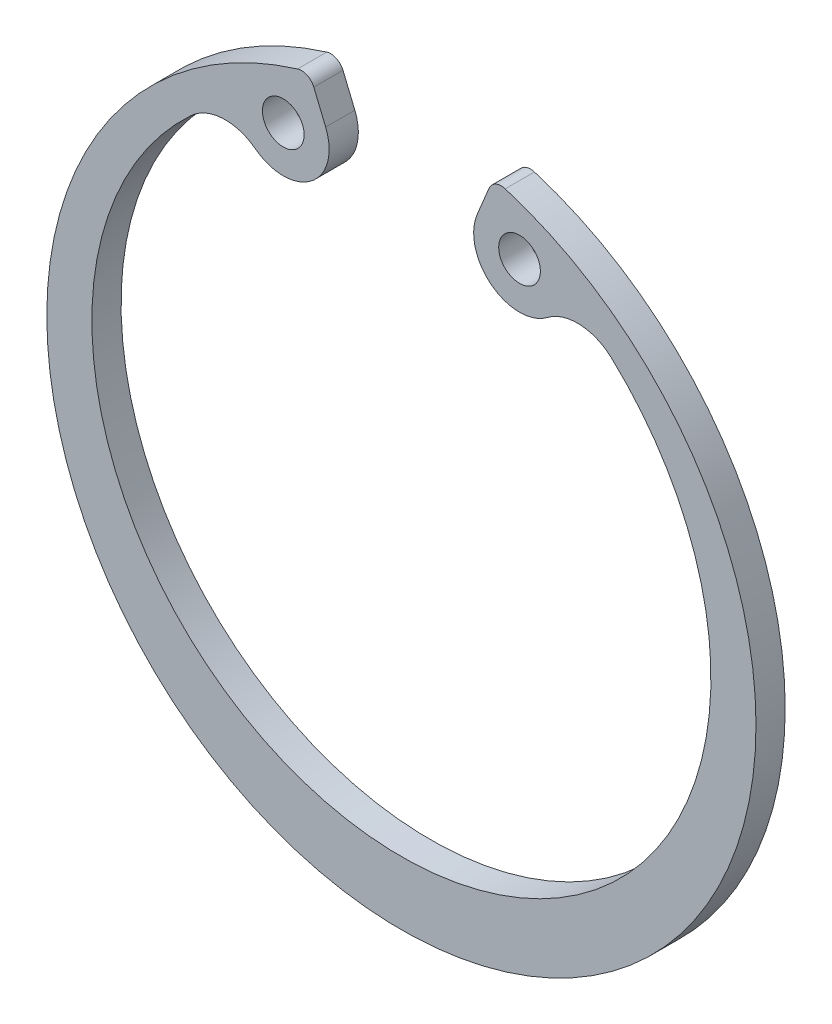
from build123d import *

# Parameters (mm, degrees)
CROQUIS1_R              = 1.25
SALIENTE_EXTRUIR1_DEPTH = 1.75


with BuildPart() as part:
    # Croquis1 → Saliente-Extruir1 (new body)
    with BuildSketch(Plane.XY.offset(1.75)):
        with BuildLine():
            Line((5.249381166, 19.859670123), (4.53882245, 18.144188898))
            ThreePointArc((4.53882245, 18.144188898), (5.400610321, 14.913797401), (8.743959767, 14.902750233))
            ThreePointArc((8.743959767, 14.902750233), (10.704311129, 15.511176573), (12.596981786, 14.716848016))
            ThreePointArc((12.596981786, 14.716848016), (0, -17.45), (-12.596981786, 14.716848016))
            ThreePointArc((-12.596981786, 14.716848016), (-10.704311129, 15.511176573), (-8.743959767, 14.902750233))
            ThreePointArc((-8.743959767, 14.902750233), (-5.400610321, 14.913797401), (-4.53882245, 18.144188898))
            Line((-4.53882245, 18.144188898), (-5.249381166, 19.859670123))
            ThreePointArc((-5.249381166, 19.859670123), (-5.64740484, 20.277175016), (-6.222755816, 20.318459835))
            ThreePointArc((-6.222755816, 20.318459835), (0, -21.25), (6.222755816, 20.318459835))
            ThreePointArc((6.222755816, 20.318459835), (5.64740484, 20.277175016), (5.249381166, 19.859670123))
        make_face()
        with Locations(Location((-7.0795, 17.09183079, 0), (0, 0, 180))):
            Circle(CROQUIS1_R, mode=Mode.SUBTRACT)
        with Locations(Location((7.0795, 17.09183079, 0), (0, 0, 180))):
            Circle(CROQUIS1_R, mode=Mode.SUBTRACT)
    extrude(amount=-SALIENTE_EXTRUIR1_DEPTH)


solid = part.part
